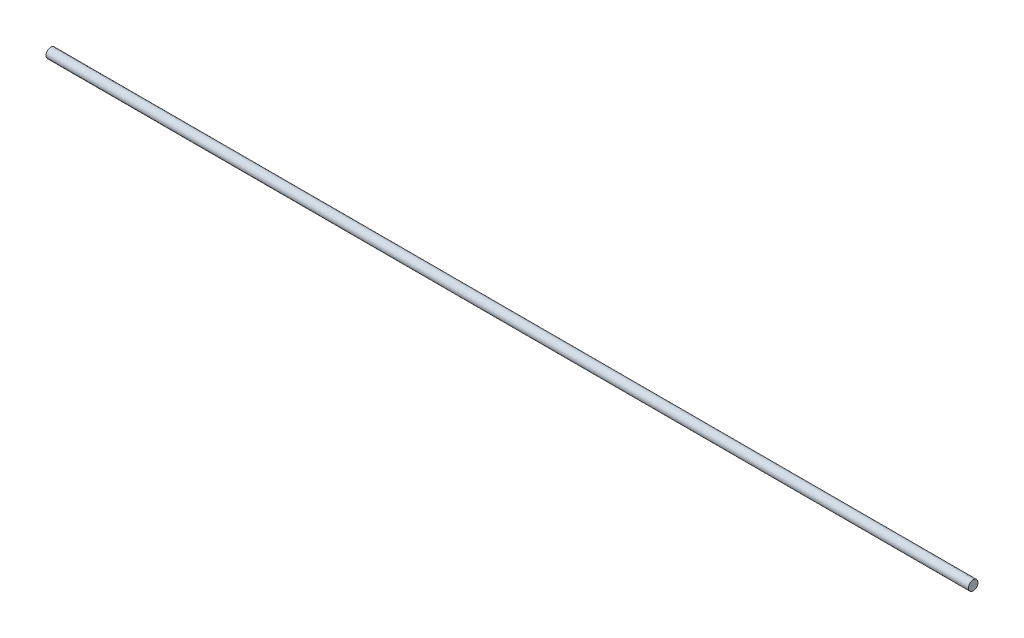
from build123d import *

# Parameters (mm, degrees)
SKETCH1_R           = 1.5625
BOSS_EXTRUDE1_DEPTH = 150


with BuildPart() as part:
    # Sketch1 → Boss-Extrude1 (new, symmetric)
    with BuildSketch(Plane(origin=(0, 0, 0), x_dir=(0, 0, -1), z_dir=(1, 0, 0))):
        Circle(SKETCH1_R)
    extrude(amount=BOSS_EXTRUDE1_DEPTH, both=True)


solid = part.part
